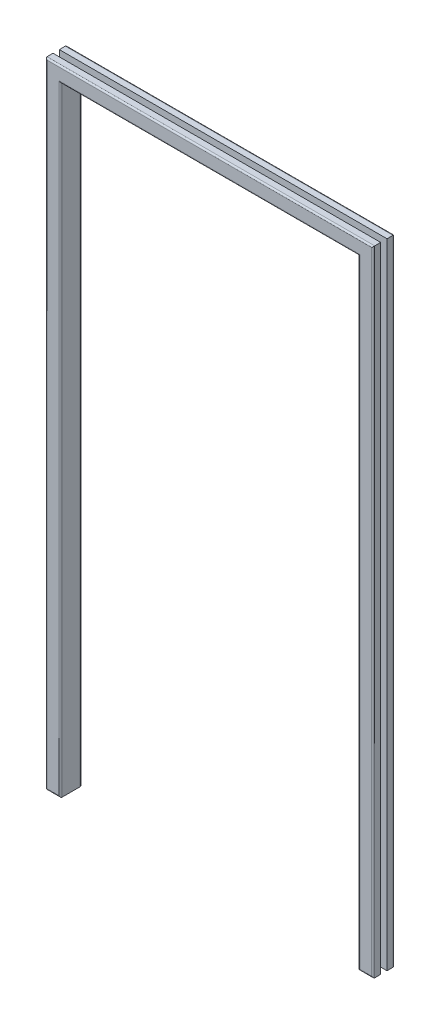
from build123d import *

# Parameters (mm, degrees)
SKETCH1_W           = 1117.6
SKETCH1_H           = 2162.175
BOSS_EXTRUDE1_DEPTH = 25.4
BOSS_EXTRUDE4_DEPTH = 21.59
SKETCH7_W           = 1117.6
SKETCH7_H           = 2162.175
BOSS_EXTRUDE5_DEPTH = 25.4
SKETCH8_W           = 1016
SKETCH8_H           = 2111.375
CUT_EXTRUDE2_DEPTH  = 2436.009405059
FILLET1_R           = 5.08


with BuildPart() as part:
    # Sketch1 → Boss-Extrude1 (new body)
    with BuildSketch(Plane.XY):
        with Locations((558.8, 1081.0875)):
            Rectangle(SKETCH1_W, SKETCH1_H)
    extrude(amount=BOSS_EXTRUDE1_DEPTH)

    # Sketch6 → Boss-Extrude4 (add)
    with BuildSketch(Plane(origin=(0, 0, 0), x_dir=(-1, 0, 0), z_dir=(0, 0, -1))):
        Polygon((-1066.8, 0), (-1092.2, 0), (-1092.2, 2136.775), (-25.4, 2136.775), (-25.4, 0), (-50.8, 0), (-50.8, 2111.375), (-1066.8, 2111.375), align=None)
    extrude(amount=BOSS_EXTRUDE4_DEPTH)

    # Sketch7 → Boss-Extrude5 (add)
    with BuildSketch(Plane(origin=(0, 0, -21.59), x_dir=(-1, 0, 0), z_dir=(0, 0, -1))):
        with Locations((-558.8, 1081.0875)):
            Rectangle(SKETCH7_W, SKETCH7_H)
    extrude(amount=BOSS_EXTRUDE5_DEPTH)

    # Sketch8 → Cut-Extrude2 (cut, through all)
    with BuildSketch(Plane.XY.offset(25.4)):
        with Locations((558.8, 1055.6875)):
            Rectangle(SKETCH8_W, SKETCH8_H)
    extrude(amount=-CUT_EXTRUDE2_DEPTH, mode=Mode.SUBTRACT)

    # Fillet1
    fillet1_edges = [part.edges().sort_by_distance(p)[0] for p in [
        (1117.6, 1081.0875, 25.4),
        (558.8, 2162.175, 25.4),
        (1117.6, 1081.0875, -46.99),
        (1092.2, 0, -46.99),
        (0, 1081.0875, -46.99),
        (558.8, 2162.175, -46.99),
        (0, 1081.0875, 25.4),
        (25.4, 0, -46.99),
        (1092.2, 0, 25.4),
        (50.8, 1055.6875, -46.99),
        (558.8, 2111.375, -46.99),
        (1066.8, 1055.6875, -46.99),
        (50.8, 1055.6875, 25.4),
        (1066.8, 1055.6875, 25.4),
        (558.8, 2111.375, 25.4),
        (25.4, 0, 25.4),
    ]]
    fillet(fillet1_edges, radius=FILLET1_R)


solid = part.part
